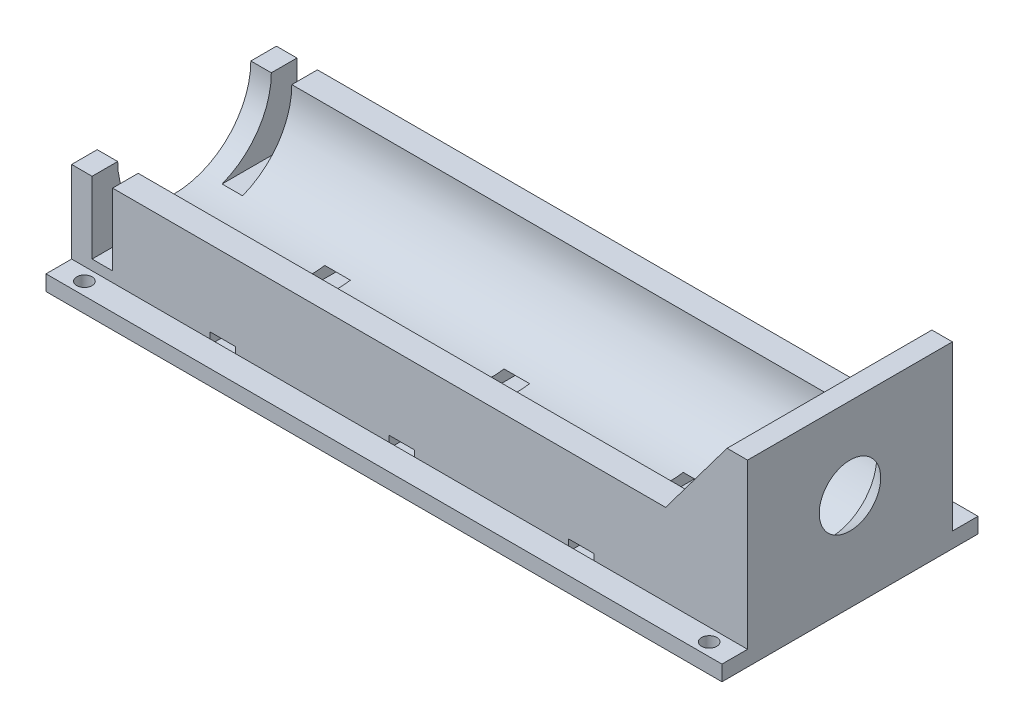
from build123d import *

# Parameters (mm, degrees)
SKETCH1_W           = 128
SKETCH1_H           = 40
BOSS_EXTRUDE1_DEPTH = 8
SKETCH2_W           = 128
SKETCH2_H           = 40
BOSS_EXTRUDE2_DEPTH = 30
CUT_EXTRUDE1_DEPTH  = 200000
SKETCH5_W           = 4
SKETCH5_H           = 40
CUT_EXTRUDE2_DEPTH  = 14
SKETCH6_W           = 40
SKETCH6_H           = 35
BOSS_EXTRUDE3_DEPTH = 4
SKETCH7_R           = 6
CUT_EXTRUDE3_DEPTH  = 4
CUT_EXTRUDE3_DRAFT  = 39
SKETCH8_W           = 5
SKETCH8_H           = 2.2
CUT_EXTRUDE4_DEPTH  = 200
SKETCH9_W           = 132
SKETCH9_H           = 5
BOSS_EXTRUDE4_DEPTH = 3
BOSS_EXTRUDE7_DEPTH = 3
BOSS_EXTRUDE9_DEPTH = 3
SKETCH13_R          = 1.5
CUT_EXTRUDE5_DEPTH  = 10


with BuildPart() as part:
    # Sketch1 → Boss-Extrude1 (new body)
    with BuildSketch(Plane(origin=(0, 0, 0), x_dir=(1, 0, 0), z_dir=(0, 1, 0))):
        Rectangle(SKETCH1_W, SKETCH1_H)
    extrude(amount=BOSS_EXTRUDE1_DEPTH)

    # Sketch2 → Boss-Extrude2 (add)
    with BuildSketch(Plane(origin=(0, 8, 0), x_dir=(1, 0, 0), z_dir=(0, 1, 0))):
        Rectangle(SKETCH2_W, SKETCH2_H)
    extrude(amount=BOSS_EXTRUDE2_DEPTH)

    # Sketch3 → Cut-Extrude1 (cut)
    with BuildSketch(Plane(origin=(64, 0, 0), x_dir=(0, 0, -1), z_dir=(1, 0, 0))):
        with BuildLine():
            Line((-15, 19), (-20, 19))
            Line((-20, 19), (-20, 38))
            Line((-20, 38), (20, 38))
            Line((20, 38), (20, 19))
            Line((20, 19), (15, 19))
            ThreePointArc((15, 19), (0, 4), (-15, 19))
        make_face()
    extrude(amount=-CUT_EXTRUDE1_DEPTH, mode=Mode.SUBTRACT)

    # Sketch5 → Cut-Extrude2 (cut)
    with BuildSketch(Plane(origin=(0, 19, 0), x_dir=(1, 0, 0), z_dir=(0, 1, 0))):
        with Locations((-58, 0)):
            Rectangle(SKETCH5_W, SKETCH5_H)
    extrude(amount=-CUT_EXTRUDE2_DEPTH, mode=Mode.SUBTRACT)

    # Sketch6 → Boss-Extrude3 (add)
    with BuildSketch(Plane(origin=(64, 0, 0), x_dir=(0, 0, -1), z_dir=(1, 0, 0))):
        with Locations((0, 17.5)):
            Rectangle(SKETCH6_W, SKETCH6_H)
    extrude(amount=BOSS_EXTRUDE3_DEPTH)


with BuildPart() as cut_extrude3_tool:
    # Sketch7 → Cut-Extrude3 (with draft: the straight prism first)
    with BuildSketch(Plane(origin=(68, 0, 0), x_dir=(0, 0, -1), z_dir=(1, 0, 0))):
        with Locations((0, 19)):
            Circle(SKETCH7_R)
    extrude(amount=-CUT_EXTRUDE3_DEPTH)
    # Cut-Extrude3: the draft: its side faces are tilted about the plane it starts from
    cut_extrude3_sides = [cut_extrude3_tool.faces().sort_by_distance(p)[0] for p in [
        (66, 19, 6),
    ]]
    draft(cut_extrude3_sides, Plane(origin=(68, 0, 0), x_dir=(0, 0, -1), z_dir=(1, 0, 0)), CUT_EXTRUDE3_DRAFT)


with BuildPart() as part_1:
    add(part.part)

    # Cut-Extrude3: cut by cut_extrude3_tool
    add(cut_extrude3_tool.part, mode=Mode.SUBTRACT)

    # Sketch8 → Cut-Extrude4 (cut)
    with BuildSketch(Plane(origin=(0, 0, -20), x_dir=(-1, 0, 0), z_dir=(0, 0, -1))):
        with Locations((-35.5, 3.1)):
            Rectangle(SKETCH8_W, SKETCH8_H)
        with Locations((34.5, 3.1)):
            Rectangle(SKETCH8_W, SKETCH8_H)
        with Locations((-0.5, 3.1)):
            Rectangle(SKETCH8_W, SKETCH8_H)
    extrude(amount=-CUT_EXTRUDE4_DEPTH, mode=Mode.SUBTRACT)

    # Sketch9 → Boss-Extrude4 (add)
    with BuildSketch(Plane.XZ):
        with Locations((2, 22.5)):
            Rectangle(SKETCH9_W, SKETCH9_H)
        with Locations((2, -22.5)):
            Rectangle(SKETCH9_W, SKETCH9_H)
    extrude(amount=-BOSS_EXTRUDE4_DEPTH)

    # Sketch10 → Boss-Extrude7 (add)
    with BuildSketch(Plane.XY.offset(20)):
        Polygon((68, 35), (64, 35), (52, 19), (68, 19), align=None)
    extrude(amount=-BOSS_EXTRUDE7_DEPTH)

    # Sketch12 → Boss-Extrude9 (add)
    with BuildSketch(Plane(origin=(0, 0, -20), x_dir=(-1, 0, 0), z_dir=(0, 0, -1))):
        Polygon((-68, 35), (-64, 35), (-51.978791145, 19), (-68, 19), align=None)
    extrude(amount=-BOSS_EXTRUDE9_DEPTH)

    # Sketch13 → Cut-Extrude5 (cut)
    with BuildSketch(Plane(origin=(0, 3, 0), x_dir=(1, 0, 0), z_dir=(0, 1, 0))):
        with Locations(Location((-59, -22.5, 0), (0, 0, 270))):
            Circle(SKETCH13_R)
        with Locations(Location((-59, 22.5, 0), (0, 0, 270))):
            Circle(SKETCH13_R)
        with Locations(Location((63, -22.5, 0), (0, 0, 270))):
            Circle(SKETCH13_R)
        with Locations(Location((63, 22.5, 0), (0, 0, 270))):
            Circle(SKETCH13_R)
    extrude(amount=-CUT_EXTRUDE5_DEPTH, mode=Mode.SUBTRACT)


solid = part_1.part
